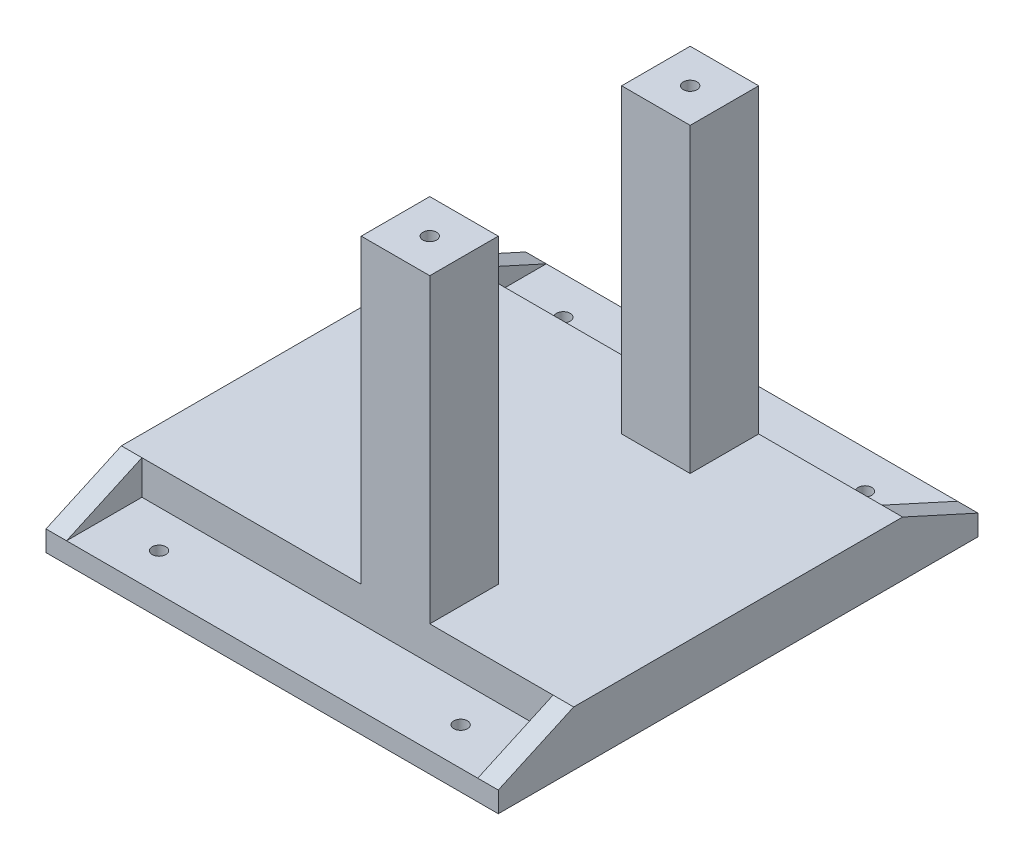
from build123d import *

# Parameters (mm, degrees)
SKETCH1_W           = 66
SKETCH1_H           = 48
BOSS_EXTRUDE1_DEPTH = 5
SKETCH2_W           = 10
SKETCH2_H           = 10
BOSS_EXTRUDE2_DEPTH = 44
SKETCH3_R           = 1
CUT_EXTRUDE1_DEPTH  = 7
SKETCH4_W           = 66
SKETCH4_H           = 70
BOSS_EXTRUDE3_DEPTH = 3
BOSS_EXTRUDE4_DEPTH = 3
SKETCH6_R           = 1
CUT_EXTRUDE2_DEPTH  = 3


with BuildPart() as part:
    # Sketch1 → Boss-Extrude1 (new body)
    with BuildSketch(Plane(origin=(0, 0, 0), x_dir=(1, 0, 0), z_dir=(0, 1, 0))):
        Rectangle(SKETCH1_W, SKETCH1_H)
    extrude(amount=BOSS_EXTRUDE1_DEPTH)

    # Sketch2 → Boss-Extrude2 (add)
    with BuildSketch(Plane(origin=(0, 5, 0), x_dir=(1, 0, 0), z_dir=(0, 1, 0))):
        with Locations((7, 19)):
            Rectangle(SKETCH2_W, SKETCH2_H)
        with Locations((7, -19)):
            Rectangle(SKETCH2_W, SKETCH2_H)
    extrude(amount=BOSS_EXTRUDE2_DEPTH)

    # Sketch3 → Cut-Extrude1 (cut)
    with BuildSketch(Plane(origin=(0, 49, 0), x_dir=(1, 0, 0), z_dir=(0, 1, 0))):
        with Locations(Location((7, 19, 0), (0, 0, 270))):
            Circle(SKETCH3_R)
        with Locations(Location((7, -19, 0), (0, 0, 270))):
            Circle(SKETCH3_R)
    extrude(amount=-CUT_EXTRUDE1_DEPTH, mode=Mode.SUBTRACT)

    # Sketch4 → Boss-Extrude3 (add)
    with BuildSketch(Plane.XZ):
        Rectangle(SKETCH4_W, SKETCH4_H)
    extrude(amount=BOSS_EXTRUDE3_DEPTH)

    # Sketch5 → Boss-Extrude4 (add)
    with BuildSketch(Plane(origin=(33, 0, 0), x_dir=(0, 0, -1), z_dir=(1, 0, 0))):
        Polygon((-24, 5), (-35, 0), (-24, 0), align=None)
        Polygon((24, 5), (24, 0), (35, 0), align=None)
    boss_extrude4 = extrude(amount=-BOSS_EXTRUDE4_DEPTH)

    # Mirror1: Boss-Extrude4 across plane
    add(boss_extrude4.mirror(Plane(origin=(0, 0, 0), x_dir=(0, 0, 1), z_dir=(1, 0, 0))))

    # Sketch6 → Cut-Extrude2 (cut)
    with BuildSketch(Plane(origin=(0, 0, 0), x_dir=(1, 0, 0), z_dir=(0, 1, 0))):
        with Locations(Location((-22, 29.5, 0), (0, 0, 270))):
            Circle(SKETCH6_R)
        with Locations(Location((22, 29.5, 0), (0, 0, 270))):
            Circle(SKETCH6_R)
    cut_extrude2 = extrude(amount=-CUT_EXTRUDE2_DEPTH, mode=Mode.SUBTRACT)

    # Mirror2: Cut-Extrude2 across plane
    add(cut_extrude2.mirror(Plane.XY), mode=Mode.SUBTRACT)


solid = part.part
